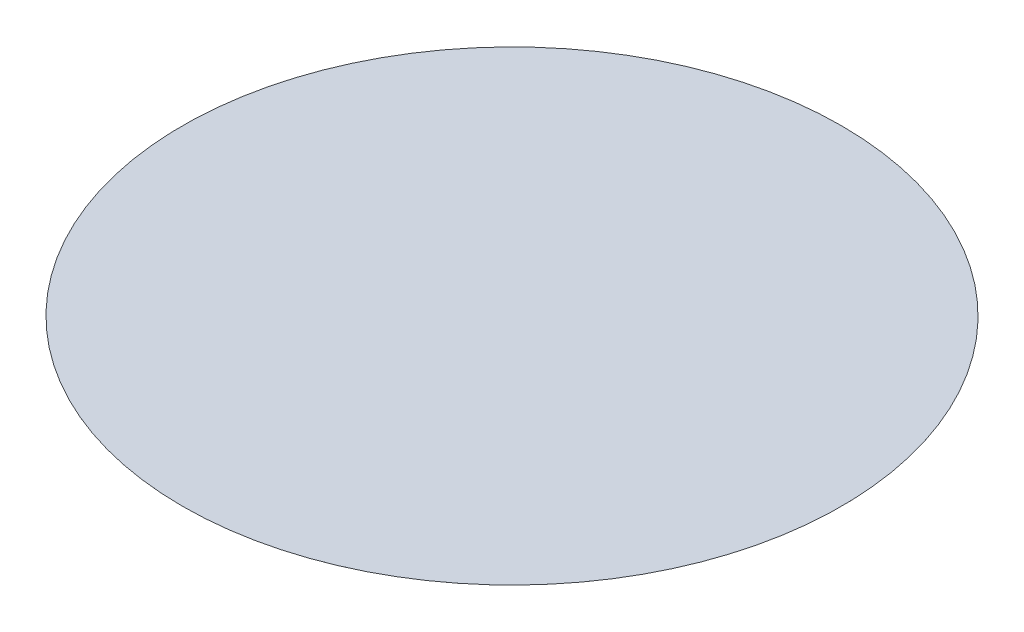
from build123d import *

# Parameters (mm, degrees)
SKETCH1_R           = 10
BOSS_EXTRUDE1_DEPTH = 0.0001


with BuildPart() as part:
    # Sketch1 → Boss-Extrude1 (new body)
    with BuildSketch(Plane(origin=(0, 0, 0), x_dir=(1, 0, 0), z_dir=(0, 1, 0))):
        with Locations(Location((0, 0, 0), (0, 0, 270))):
            Circle(SKETCH1_R)
    extrude(amount=BOSS_EXTRUDE1_DEPTH)


solid = part.part
